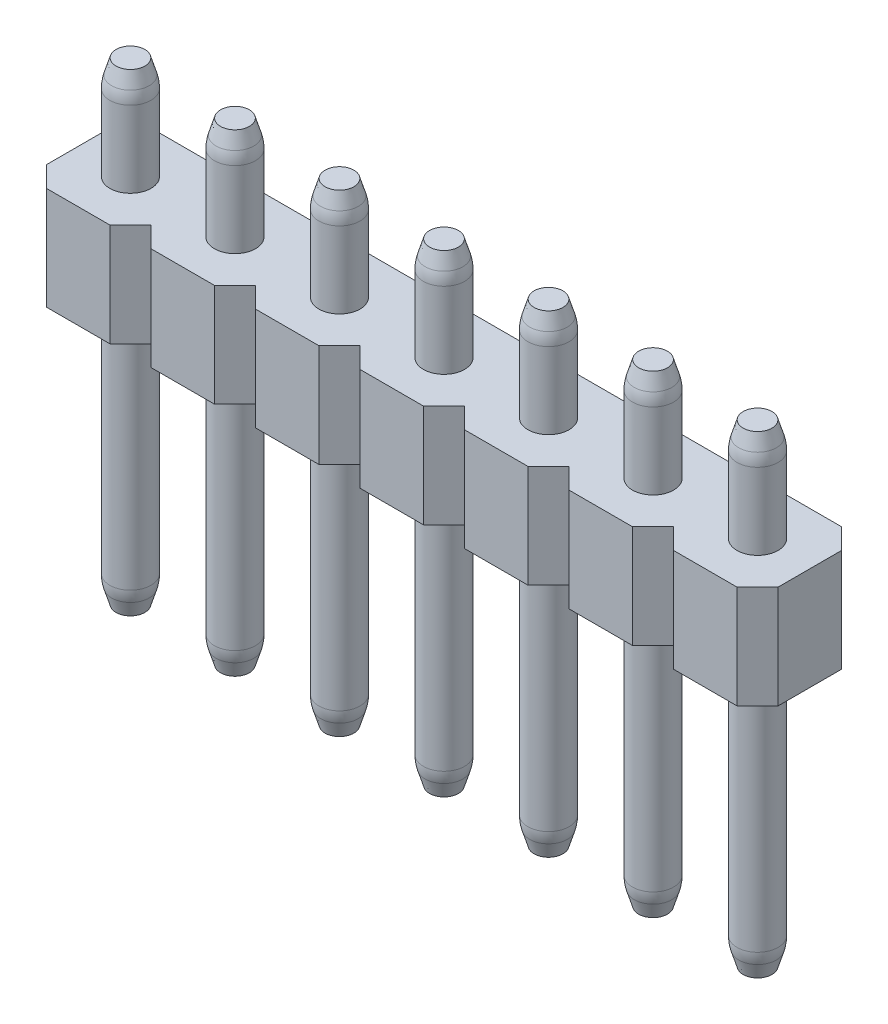
from build123d import *
from OCP.BRepFilletAPI import BRepFilletAPI_MakeChamfer

# Parameters (mm, degrees)
SKETCH1_R               = 0.5
BOSS_EXTRUDE1_DEPTH     = 11.5
BOSS_EXTRUDE1_2_DEPTH   = 11.5
BOSS_EXTRUDE1_3_DEPTH   = 11.5
BOSS_EXTRUDE1_4_DEPTH   = 11.5
BOSS_EXTRUDE1_5_DEPTH   = 11.5
BOSS_EXTRUDE1_6_DEPTH   = 11.5
BOSS_EXTRUDE1_7_DEPTH   = 11.5
BOSS_EXTRUDE1_8_DEPTH   = 11.5
BOSS_EXTRUDE1_9_DEPTH   = 11.5
BOSS_EXTRUDE1_10_DEPTH  = 11.5
BOSS_EXTRUDE1_11_DEPTH  = 11.5
BOSS_EXTRUDE1_12_DEPTH  = 11.5
BOSS_EXTRUDE1_13_DEPTH  = 11.5
BOSS_EXTRUDE1_14_DEPTH  = 11.5
BOSS_EXTRUDE1_15_DEPTH  = 11.5
BOSS_EXTRUDE1_16_DEPTH  = 11.5
BOSS_EXTRUDE2_DEPTH     = 2.5
CHAMFER1_SIZE           = 0.5
CHAMFER1_SIZE2          = 0.15
FILLET1_R               = 1
CHAMFER2_SIZE           = 0.15
CHAMFER2_SIZE2          = 0.5
FILLET2_R               = 1
CUT_EXTRUDE1_DEPTH      = 42.093776929
CUT_EXTRUDE1_DEPTH_BACK = 42.093776929
SKETCH3_W               = 22.86
SKETCH3_H               = 11.5


with BuildPart() as part:
    # Sketch1 → Boss-Extrude1 (new body)
    with BuildSketch(Plane(origin=(0, 0, 0), x_dir=(1, 0, 0), z_dir=(0, 1, 0))):
        with Locations(Location((0, 0, 0), (0, 0, 270))):
            Circle(SKETCH1_R)
    extrude(amount=BOSS_EXTRUDE1_DEPTH)



with BuildPart() as body_2:
    # Sketch1 → Boss-Extrude1 2 (new body)
    with BuildSketch(Plane(origin=(0, 0, 0), x_dir=(1, 0, 0), z_dir=(0, 1, 0))):
        with Locations(Location((2.54, 0, 0), (0, 0, 270))):
            Circle(SKETCH1_R)
    extrude(amount=BOSS_EXTRUDE1_2_DEPTH)


with BuildPart() as body_3:
    # Sketch1 → Boss-Extrude1 3 (new body)
    with BuildSketch(Plane(origin=(0, 0, 0), x_dir=(1, 0, 0), z_dir=(0, 1, 0))):
        with Locations(Location((5.08, 0, 0), (0, 0, 270))):
            Circle(SKETCH1_R)
    extrude(amount=BOSS_EXTRUDE1_3_DEPTH)


with BuildPart() as body_4:
    # Sketch1 → Boss-Extrude1 4 (new body)
    with BuildSketch(Plane(origin=(0, 0, 0), x_dir=(1, 0, 0), z_dir=(0, 1, 0))):
        with Locations(Location((7.62, 0, 0), (0, 0, 270))):
            Circle(SKETCH1_R)
    extrude(amount=BOSS_EXTRUDE1_4_DEPTH)


with BuildPart() as body_5:
    # Sketch1 → Boss-Extrude1 5 (new body)
    with BuildSketch(Plane(origin=(0, 0, 0), x_dir=(1, 0, 0), z_dir=(0, 1, 0))):
        with Locations(Location((10.16, 0, 0), (0, 0, 270))):
            Circle(SKETCH1_R)
    extrude(amount=BOSS_EXTRUDE1_5_DEPTH)


with BuildPart() as body_6:
    # Sketch1 → Boss-Extrude1 6 (new body)
    with BuildSketch(Plane(origin=(0, 0, 0), x_dir=(1, 0, 0), z_dir=(0, 1, 0))):
        with Locations(Location((12.7, 0, 0), (0, 0, 270))):
            Circle(SKETCH1_R)
    extrude(amount=BOSS_EXTRUDE1_6_DEPTH)


with BuildPart() as body_7:
    # Sketch1 → Boss-Extrude1 7 (new body)
    with BuildSketch(Plane(origin=(0, 0, 0), x_dir=(1, 0, 0), z_dir=(0, 1, 0))):
        with Locations(Location((15.24, 0, 0), (0, 0, 270))):
            Circle(SKETCH1_R)
    extrude(amount=BOSS_EXTRUDE1_7_DEPTH)


with BuildPart() as body_8:
    # Sketch1 → Boss-Extrude1 8 (new body)
    with BuildSketch(Plane(origin=(0, 0, 0), x_dir=(1, 0, 0), z_dir=(0, 1, 0))):
        with Locations(Location((17.78, 0, 0), (0, 0, 270))):
            Circle(SKETCH1_R)
    extrude(amount=BOSS_EXTRUDE1_8_DEPTH)


with BuildPart() as body_9:
    # Sketch1 → Boss-Extrude1 9 (new body)
    with BuildSketch(Plane(origin=(0, 0, 0), x_dir=(1, 0, 0), z_dir=(0, 1, 0))):
        with Locations(Location((20.32, 0, 0), (0, 0, 270))):
            Circle(SKETCH1_R)
    extrude(amount=BOSS_EXTRUDE1_9_DEPTH)


with BuildPart() as body_10:
    # Sketch1 → Boss-Extrude1 10 (new body)
    with BuildSketch(Plane(origin=(0, 0, 0), x_dir=(1, 0, 0), z_dir=(0, 1, 0))):
        with Locations(Location((22.86, 0, 0), (0, 0, 270))):
            Circle(SKETCH1_R)
    extrude(amount=BOSS_EXTRUDE1_10_DEPTH)


with BuildPart() as body_11:
    # Sketch1 → Boss-Extrude1 11 (new body)
    with BuildSketch(Plane(origin=(0, 0, 0), x_dir=(1, 0, 0), z_dir=(0, 1, 0))):
        with Locations(Location((25.4, 0, 0), (0, 0, 270))):
            Circle(SKETCH1_R)
    extrude(amount=BOSS_EXTRUDE1_11_DEPTH)


with BuildPart() as body_12:
    # Sketch1 → Boss-Extrude1 12 (new body)
    with BuildSketch(Plane(origin=(0, 0, 0), x_dir=(1, 0, 0), z_dir=(0, 1, 0))):
        with Locations(Location((27.94, 0, 0), (0, 0, 270))):
            Circle(SKETCH1_R)
    extrude(amount=BOSS_EXTRUDE1_12_DEPTH)


with BuildPart() as body_13:
    # Sketch1 → Boss-Extrude1 13 (new body)
    with BuildSketch(Plane(origin=(0, 0, 0), x_dir=(1, 0, 0), z_dir=(0, 1, 0))):
        with Locations(Location((30.48, 0, 0), (0, 0, 270))):
            Circle(SKETCH1_R)
    extrude(amount=BOSS_EXTRUDE1_13_DEPTH)


with BuildPart() as body_14:
    # Sketch1 → Boss-Extrude1 14 (new body)
    with BuildSketch(Plane(origin=(0, 0, 0), x_dir=(1, 0, 0), z_dir=(0, 1, 0))):
        with Locations(Location((33.02, 0, 0), (0, 0, 270))):
            Circle(SKETCH1_R)
    extrude(amount=BOSS_EXTRUDE1_14_DEPTH)


with BuildPart() as body_15:
    # Sketch1 → Boss-Extrude1 15 (new body)
    with BuildSketch(Plane(origin=(0, 0, 0), x_dir=(1, 0, 0), z_dir=(0, 1, 0))):
        with Locations(Location((35.56, 0, 0), (0, 0, 270))):
            Circle(SKETCH1_R)
    extrude(amount=BOSS_EXTRUDE1_15_DEPTH)


with BuildPart() as body_16:
    # Sketch1 → Boss-Extrude1 16 (new body)
    with BuildSketch(Plane(origin=(0, 0, 0), x_dir=(1, 0, 0), z_dir=(0, 1, 0))):
        with Locations(Location((38.1, 0, 0), (0, 0, 270))):
            Circle(SKETCH1_R)
    extrude(amount=BOSS_EXTRUDE1_16_DEPTH)


with BuildPart() as part_1:
    add(part.part)

    add(body_2.part)  # Boss-Extrude2 merges body 2

    add(body_3.part)  # Boss-Extrude2 merges body 3

    add(body_4.part)  # Boss-Extrude2 merges body 4

    add(body_5.part)  # Boss-Extrude2 merges body 5

    add(body_6.part)  # Boss-Extrude2 merges body 6

    add(body_7.part)  # Boss-Extrude2 merges body 7

    add(body_8.part)  # Boss-Extrude2 merges body 8

    add(body_9.part)  # Boss-Extrude2 merges body 9

    add(body_10.part)  # Boss-Extrude2 merges body 10

    add(body_11.part)  # Boss-Extrude2 merges body 11

    add(body_12.part)  # Boss-Extrude2 merges body 12

    add(body_13.part)  # Boss-Extrude2 merges body 13

    add(body_14.part)  # Boss-Extrude2 merges body 14

    add(body_15.part)  # Boss-Extrude2 merges body 15

    add(body_16.part)  # Boss-Extrude2 merges body 16
    # Sketch2 → Boss-Extrude2 (add)
    with BuildSketch(Plane(origin=(0, 6.5, 0), x_dir=(1, 0, 0), z_dir=(0, 1, 0))):
        Polygon((-1.27, 0.77), (-0.77, 1.27), (0.77, 1.27), (1.27, 0.77), (1.77, 1.27), (3.31, 1.27), (3.81, 0.77), (4.31, 1.27), (5.85, 1.27), (6.35, 0.77), (6.85, 1.27), (8.39, 1.27), (8.89, 0.77), (9.39, 1.27), (10.93, 1.27), (11.43, 0.77), (11.93, 1.27), (13.47, 1.27), (13.97, 0.77), (14.47, 1.27), (16.01, 1.27), (16.51, 0.77), (17.01, 1.27), (18.55, 1.27), (19.05, 0.77), (19.55, 1.27), (21.09, 1.27), (21.59, 0.77), (22.09, 1.27), (23.63, 1.27), (24.13, 0.77), (24.63, 1.27), (26.17, 1.27), (26.67, 0.77), (27.17, 1.27), (28.71, 1.27), (29.21, 0.77), (29.71, 1.27), (31.25, 1.27), (31.75, 0.77), (32.25, 1.27), (33.79, 1.27), (34.29, 0.77), (34.79, 1.27), (36.33, 1.27), (36.83, 0.77), (37.33, 1.27), (38.87, 1.27), (39.37, 0.77), (39.37, -0.77), (38.87, -1.27), (37.33, -1.27), (36.83, -0.77), (36.33, -1.27), (34.79, -1.27), (34.29, -0.77), (33.79, -1.27), (32.25, -1.27), (31.75, -0.77), (31.25, -1.27), (29.71, -1.27), (29.21, -0.77), (28.71, -1.27), (27.17, -1.27), (26.67, -0.77), (26.17, -1.27), (24.63, -1.27), (24.13, -0.77), (23.63, -1.27), (22.09, -1.27), (21.59, -0.77), (21.09, -1.27), (19.55, -1.27), (19.05, -0.77), (18.55, -1.27), (17.01, -1.27), (16.51, -0.77), (16.01, -1.27), (14.47, -1.27), (13.97, -0.77), (13.47, -1.27), (11.93, -1.27), (11.43, -0.77), (10.93, -1.27), (9.39, -1.27), (8.89, -0.77), (8.39, -1.27), (6.85, -1.27), (6.35, -0.77), (5.85, -1.27), (4.31, -1.27), (3.81, -0.77), (3.31, -1.27), (1.77, -1.27), (1.27, -0.77), (0.77, -1.27), (-0.77, -1.27), (-1.27, -0.77), align=None)
    extrude(amount=BOSS_EXTRUDE2_DEPTH)

    # Chamfer1: one chamfer whose edges measure the first distance from different faces: ONE call of the kernel's chamfer builder (chamfer() names one face for all edges)
    chamfer1_edges_1 = [part_1.edges().sort_by_distance(p)[0] for p in [
        (2.54, 11.5, -0.5),
    ]]
    chamfer1_side_1 = [part_1.faces().sort_by_distance(p)[0] for p in [
        (2.54, 10.25, -0.5),
    ]]
    chamfer1_edges_2 = [part_1.edges().sort_by_distance(p)[0] for p in [
        (5.08, 11.5, -0.5),
    ]]
    chamfer1_side_2 = [part_1.faces().sort_by_distance(p)[0] for p in [
        (5.08, 10.25, -0.5),
    ]]
    chamfer1_edges_3 = [part_1.edges().sort_by_distance(p)[0] for p in [
        (7.62, 11.5, -0.5),
    ]]
    chamfer1_side_3 = [part_1.faces().sort_by_distance(p)[0] for p in [
        (7.62, 10.25, -0.5),
    ]]
    chamfer1_edges_4 = [part_1.edges().sort_by_distance(p)[0] for p in [
        (10.16, 11.5, -0.5),
    ]]
    chamfer1_side_4 = [part_1.faces().sort_by_distance(p)[0] for p in [
        (10.16, 10.25, -0.5),
    ]]
    chamfer1_edges_5 = [part_1.edges().sort_by_distance(p)[0] for p in [
        (12.7, 11.5, -0.5),
    ]]
    chamfer1_side_5 = [part_1.faces().sort_by_distance(p)[0] for p in [
        (12.7, 10.25, -0.5),
    ]]
    chamfer1_edges_6 = [part_1.edges().sort_by_distance(p)[0] for p in [
        (15.24, 11.5, -0.5),
    ]]
    chamfer1_side_6 = [part_1.faces().sort_by_distance(p)[0] for p in [
        (15.24, 10.25, -0.5),
    ]]
    chamfer1_edges_7 = [part_1.edges().sort_by_distance(p)[0] for p in [
        (17.78, 11.5, -0.5),
    ]]
    chamfer1_side_7 = [part_1.faces().sort_by_distance(p)[0] for p in [
        (17.78, 10.25, -0.5),
    ]]
    chamfer1_edges_8 = [part_1.edges().sort_by_distance(p)[0] for p in [
        (20.32, 11.5, -0.5),
    ]]
    chamfer1_side_8 = [part_1.faces().sort_by_distance(p)[0] for p in [
        (20.32, 10.25, -0.5),
    ]]
    chamfer1_edges_9 = [part_1.edges().sort_by_distance(p)[0] for p in [
        (22.86, 11.5, -0.5),
    ]]
    chamfer1_side_9 = [part_1.faces().sort_by_distance(p)[0] for p in [
        (22.86, 10.25, -0.5),
    ]]
    chamfer1_edges_10 = [part_1.edges().sort_by_distance(p)[0] for p in [
        (25.4, 11.5, -0.5),
    ]]
    chamfer1_side_10 = [part_1.faces().sort_by_distance(p)[0] for p in [
        (25.4, 10.25, -0.5),
    ]]
    chamfer1_edges_11 = [part_1.edges().sort_by_distance(p)[0] for p in [
        (27.94, 11.5, -0.5),
    ]]
    chamfer1_side_11 = [part_1.faces().sort_by_distance(p)[0] for p in [
        (27.94, 10.25, -0.5),
    ]]
    chamfer1_edges_12 = [part_1.edges().sort_by_distance(p)[0] for p in [
        (30.48, 11.5, -0.5),
    ]]
    chamfer1_side_12 = [part_1.faces().sort_by_distance(p)[0] for p in [
        (30.48, 10.25, -0.5),
    ]]
    chamfer1_edges_13 = [part_1.edges().sort_by_distance(p)[0] for p in [
        (33.02, 11.5, -0.5),
    ]]
    chamfer1_side_13 = [part_1.faces().sort_by_distance(p)[0] for p in [
        (33.02, 10.25, -0.5),
    ]]
    chamfer1_edges_14 = [part_1.edges().sort_by_distance(p)[0] for p in [
        (35.56, 11.5, -0.5),
    ]]
    chamfer1_side_14 = [part_1.faces().sort_by_distance(p)[0] for p in [
        (35.56, 10.25, -0.5),
    ]]
    chamfer1_edges_15 = [part_1.edges().sort_by_distance(p)[0] for p in [
        (38.1, 11.5, -0.5),
    ]]
    chamfer1_side_15 = [part_1.faces().sort_by_distance(p)[0] for p in [
        (38.1, 10.25, -0.5),
    ]]
    chamfer1_edges_16 = [part_1.edges().sort_by_distance(p)[0] for p in [
        (0, 11.5, -0.5),
    ]]
    chamfer1_side_16 = [part_1.faces().sort_by_distance(p)[0] for p in [
        (0, 10.25, -0.5),
    ]]
    chamfer1 = BRepFilletAPI_MakeChamfer(part_1.part.solid().wrapped)
    for e in chamfer1_edges_1:
        chamfer1.Add(CHAMFER1_SIZE, CHAMFER1_SIZE2, e.wrapped, chamfer1_side_1[0].wrapped)  # the first distance lies on this face
    for e in chamfer1_edges_2:
        chamfer1.Add(CHAMFER1_SIZE, CHAMFER1_SIZE2, e.wrapped, chamfer1_side_2[0].wrapped)  # the first distance lies on this face
    for e in chamfer1_edges_3:
        chamfer1.Add(CHAMFER1_SIZE, CHAMFER1_SIZE2, e.wrapped, chamfer1_side_3[0].wrapped)  # the first distance lies on this face
    for e in chamfer1_edges_4:
        chamfer1.Add(CHAMFER1_SIZE, CHAMFER1_SIZE2, e.wrapped, chamfer1_side_4[0].wrapped)  # the first distance lies on this face
    for e in chamfer1_edges_5:
        chamfer1.Add(CHAMFER1_SIZE, CHAMFER1_SIZE2, e.wrapped, chamfer1_side_5[0].wrapped)  # the first distance lies on this face
    for e in chamfer1_edges_6:
        chamfer1.Add(CHAMFER1_SIZE, CHAMFER1_SIZE2, e.wrapped, chamfer1_side_6[0].wrapped)  # the first distance lies on this face
    for e in chamfer1_edges_7:
        chamfer1.Add(CHAMFER1_SIZE, CHAMFER1_SIZE2, e.wrapped, chamfer1_side_7[0].wrapped)  # the first distance lies on this face
    for e in chamfer1_edges_8:
        chamfer1.Add(CHAMFER1_SIZE, CHAMFER1_SIZE2, e.wrapped, chamfer1_side_8[0].wrapped)  # the first distance lies on this face
    for e in chamfer1_edges_9:
        chamfer1.Add(CHAMFER1_SIZE, CHAMFER1_SIZE2, e.wrapped, chamfer1_side_9[0].wrapped)  # the first distance lies on this face
    for e in chamfer1_edges_10:
        chamfer1.Add(CHAMFER1_SIZE, CHAMFER1_SIZE2, e.wrapped, chamfer1_side_10[0].wrapped)  # the first distance lies on this face
    for e in chamfer1_edges_11:
        chamfer1.Add(CHAMFER1_SIZE, CHAMFER1_SIZE2, e.wrapped, chamfer1_side_11[0].wrapped)  # the first distance lies on this face
    for e in chamfer1_edges_12:
        chamfer1.Add(CHAMFER1_SIZE, CHAMFER1_SIZE2, e.wrapped, chamfer1_side_12[0].wrapped)  # the first distance lies on this face
    for e in chamfer1_edges_13:
        chamfer1.Add(CHAMFER1_SIZE, CHAMFER1_SIZE2, e.wrapped, chamfer1_side_13[0].wrapped)  # the first distance lies on this face
    for e in chamfer1_edges_14:
        chamfer1.Add(CHAMFER1_SIZE, CHAMFER1_SIZE2, e.wrapped, chamfer1_side_14[0].wrapped)  # the first distance lies on this face
    for e in chamfer1_edges_15:
        chamfer1.Add(CHAMFER1_SIZE, CHAMFER1_SIZE2, e.wrapped, chamfer1_side_15[0].wrapped)  # the first distance lies on this face
    for e in chamfer1_edges_16:
        chamfer1.Add(CHAMFER1_SIZE, CHAMFER1_SIZE2, e.wrapped, chamfer1_side_16[0].wrapped)  # the first distance lies on this face
    add(Compound.cast(chamfer1.Shape()), mode=Mode.REPLACE)

    # Fillet1
    fillet1_edges = [part_1.edges().sort_by_distance(p)[0] for p in [
        (38.1, 11, -0.5),
        (35.56, 11, -0.5),
        (33.02, 11, -0.5),
        (30.48, 11, -0.5),
        (27.94, 11, -0.5),
        (25.4, 11, -0.5),
        (22.86, 11, -0.5),
        (20.32, 11, -0.5),
        (17.78, 11, -0.5),
        (15.24, 11, -0.5),
        (12.7, 11, -0.5),
        (10.16, 11, -0.5),
        (7.62, 11, -0.5),
        (5.08, 11, -0.5),
        (2.54, 11, -0.5),
        (0, 11, -0.5),
    ]]
    fillet(fillet1_edges, radius=FILLET1_R)

    # Chamfer2: one chamfer whose edges measure the first distance from different faces: ONE call of the kernel's chamfer builder (chamfer() names one face for all edges)
    chamfer2_edges_1 = [part_1.edges().sort_by_distance(p)[0] for p in [
        (0, 0, -0.5),
    ]]
    chamfer2_side_1 = [part_1.faces().sort_by_distance(p)[0] for p in [
        (0, 0, 0),
    ]]
    chamfer2_edges_2 = [part_1.edges().sort_by_distance(p)[0] for p in [
        (2.54, 0, -0.5),
    ]]
    chamfer2_side_2 = [part_1.faces().sort_by_distance(p)[0] for p in [
        (2.54, 0, 0),
    ]]
    chamfer2_edges_3 = [part_1.edges().sort_by_distance(p)[0] for p in [
        (5.08, 0, -0.5),
    ]]
    chamfer2_side_3 = [part_1.faces().sort_by_distance(p)[0] for p in [
        (5.08, 0, 0),
    ]]
    chamfer2_edges_4 = [part_1.edges().sort_by_distance(p)[0] for p in [
        (7.62, 0, -0.5),
    ]]
    chamfer2_side_4 = [part_1.faces().sort_by_distance(p)[0] for p in [
        (7.62, 0, 0),
    ]]
    chamfer2_edges_5 = [part_1.edges().sort_by_distance(p)[0] for p in [
        (10.16, 0, -0.5),
    ]]
    chamfer2_side_5 = [part_1.faces().sort_by_distance(p)[0] for p in [
        (10.16, 0, 0),
    ]]
    chamfer2_edges_6 = [part_1.edges().sort_by_distance(p)[0] for p in [
        (12.7, 0, -0.5),
    ]]
    chamfer2_side_6 = [part_1.faces().sort_by_distance(p)[0] for p in [
        (12.7, 0, 0),
    ]]
    chamfer2_edges_7 = [part_1.edges().sort_by_distance(p)[0] for p in [
        (15.24, 0, -0.5),
    ]]
    chamfer2_side_7 = [part_1.faces().sort_by_distance(p)[0] for p in [
        (15.24, 0, 0),
    ]]
    chamfer2_edges_8 = [part_1.edges().sort_by_distance(p)[0] for p in [
        (17.78, 0, -0.5),
    ]]
    chamfer2_side_8 = [part_1.faces().sort_by_distance(p)[0] for p in [
        (17.78, 0, 0),
    ]]
    chamfer2_edges_9 = [part_1.edges().sort_by_distance(p)[0] for p in [
        (20.32, 0, -0.5),
    ]]
    chamfer2_side_9 = [part_1.faces().sort_by_distance(p)[0] for p in [
        (20.32, 0, 0),
    ]]
    chamfer2_edges_10 = [part_1.edges().sort_by_distance(p)[0] for p in [
        (22.86, 0, -0.5),
    ]]
    chamfer2_side_10 = [part_1.faces().sort_by_distance(p)[0] for p in [
        (22.86, 0, 0),
    ]]
    chamfer2_edges_11 = [part_1.edges().sort_by_distance(p)[0] for p in [
        (25.4, 0, -0.5),
    ]]
    chamfer2_side_11 = [part_1.faces().sort_by_distance(p)[0] for p in [
        (25.4, 0, 0),
    ]]
    chamfer2_edges_12 = [part_1.edges().sort_by_distance(p)[0] for p in [
        (27.94, 0, -0.5),
    ]]
    chamfer2_side_12 = [part_1.faces().sort_by_distance(p)[0] for p in [
        (27.94, 0, 0),
    ]]
    chamfer2_edges_13 = [part_1.edges().sort_by_distance(p)[0] for p in [
        (30.48, 0, -0.5),
    ]]
    chamfer2_side_13 = [part_1.faces().sort_by_distance(p)[0] for p in [
        (30.48, 0, 0),
    ]]
    chamfer2_edges_14 = [part_1.edges().sort_by_distance(p)[0] for p in [
        (33.02, 0, -0.5),
    ]]
    chamfer2_side_14 = [part_1.faces().sort_by_distance(p)[0] for p in [
        (33.02, 0, 0),
    ]]
    chamfer2_edges_15 = [part_1.edges().sort_by_distance(p)[0] for p in [
        (35.56, 0, -0.5),
    ]]
    chamfer2_side_15 = [part_1.faces().sort_by_distance(p)[0] for p in [
        (35.56, 0, 0),
    ]]
    chamfer2_edges_16 = [part_1.edges().sort_by_distance(p)[0] for p in [
        (38.1, 0, -0.5),
    ]]
    chamfer2_side_16 = [part_1.faces().sort_by_distance(p)[0] for p in [
        (38.1, 0, 0),
    ]]
    chamfer2 = BRepFilletAPI_MakeChamfer(part_1.part.solid().wrapped)
    for e in chamfer2_edges_1:
        chamfer2.Add(CHAMFER2_SIZE, CHAMFER2_SIZE2, e.wrapped, chamfer2_side_1[0].wrapped)  # the first distance lies on this face
    for e in chamfer2_edges_2:
        chamfer2.Add(CHAMFER2_SIZE, CHAMFER2_SIZE2, e.wrapped, chamfer2_side_2[0].wrapped)  # the first distance lies on this face
    for e in chamfer2_edges_3:
        chamfer2.Add(CHAMFER2_SIZE, CHAMFER2_SIZE2, e.wrapped, chamfer2_side_3[0].wrapped)  # the first distance lies on this face
    for e in chamfer2_edges_4:
        chamfer2.Add(CHAMFER2_SIZE, CHAMFER2_SIZE2, e.wrapped, chamfer2_side_4[0].wrapped)  # the first distance lies on this face
    for e in chamfer2_edges_5:
        chamfer2.Add(CHAMFER2_SIZE, CHAMFER2_SIZE2, e.wrapped, chamfer2_side_5[0].wrapped)  # the first distance lies on this face
    for e in chamfer2_edges_6:
        chamfer2.Add(CHAMFER2_SIZE, CHAMFER2_SIZE2, e.wrapped, chamfer2_side_6[0].wrapped)  # the first distance lies on this face
    for e in chamfer2_edges_7:
        chamfer2.Add(CHAMFER2_SIZE, CHAMFER2_SIZE2, e.wrapped, chamfer2_side_7[0].wrapped)  # the first distance lies on this face
    for e in chamfer2_edges_8:
        chamfer2.Add(CHAMFER2_SIZE, CHAMFER2_SIZE2, e.wrapped, chamfer2_side_8[0].wrapped)  # the first distance lies on this face
    for e in chamfer2_edges_9:
        chamfer2.Add(CHAMFER2_SIZE, CHAMFER2_SIZE2, e.wrapped, chamfer2_side_9[0].wrapped)  # the first distance lies on this face
    for e in chamfer2_edges_10:
        chamfer2.Add(CHAMFER2_SIZE, CHAMFER2_SIZE2, e.wrapped, chamfer2_side_10[0].wrapped)  # the first distance lies on this face
    for e in chamfer2_edges_11:
        chamfer2.Add(CHAMFER2_SIZE, CHAMFER2_SIZE2, e.wrapped, chamfer2_side_11[0].wrapped)  # the first distance lies on this face
    for e in chamfer2_edges_12:
        chamfer2.Add(CHAMFER2_SIZE, CHAMFER2_SIZE2, e.wrapped, chamfer2_side_12[0].wrapped)  # the first distance lies on this face
    for e in chamfer2_edges_13:
        chamfer2.Add(CHAMFER2_SIZE, CHAMFER2_SIZE2, e.wrapped, chamfer2_side_13[0].wrapped)  # the first distance lies on this face
    for e in chamfer2_edges_14:
        chamfer2.Add(CHAMFER2_SIZE, CHAMFER2_SIZE2, e.wrapped, chamfer2_side_14[0].wrapped)  # the first distance lies on this face
    for e in chamfer2_edges_15:
        chamfer2.Add(CHAMFER2_SIZE, CHAMFER2_SIZE2, e.wrapped, chamfer2_side_15[0].wrapped)  # the first distance lies on this face
    for e in chamfer2_edges_16:
        chamfer2.Add(CHAMFER2_SIZE, CHAMFER2_SIZE2, e.wrapped, chamfer2_side_16[0].wrapped)  # the first distance lies on this face
    add(Compound.cast(chamfer2.Shape()), mode=Mode.REPLACE)

    # Fillet2
    fillet2_edges = [part_1.edges().sort_by_distance(p)[0] for p in [
        (10.16, 0.5, -0.5),
        (17.78, 0.5, -0.5),
        (22.86, 0.5, -0.5),
        (27.94, 0.5, -0.5),
        (30.48, 0.5, -0.5),
        (0, 0.5, -0.5),
        (2.54, 0.5, -0.5),
        (5.08, 0.5, -0.5),
        (7.62, 0.5, -0.5),
        (12.7, 0.5, -0.5),
        (15.24, 0.5, -0.5),
        (20.32, 0.5, -0.5),
        (25.4, 0.5, -0.5),
        (33.02, 0.5, -0.5),
        (35.56, 0.5, -0.5),
        (38.1, 0.5, -0.5),
    ]]
    fillet(fillet2_edges, radius=FILLET2_R)

    # Sketch3 → Cut-Extrude1 (cut, two sides: drawn at the far end of the back side and taken through both)
    with BuildSketch(Plane.XY.offset(1.27).offset(-CUT_EXTRUDE1_DEPTH_BACK)):
        with Locations((27.94, 5.75)):
            Rectangle(SKETCH3_W, SKETCH3_H)
    extrude(amount=CUT_EXTRUDE1_DEPTH + CUT_EXTRUDE1_DEPTH_BACK, mode=Mode.SUBTRACT)


solid = part_1.part
